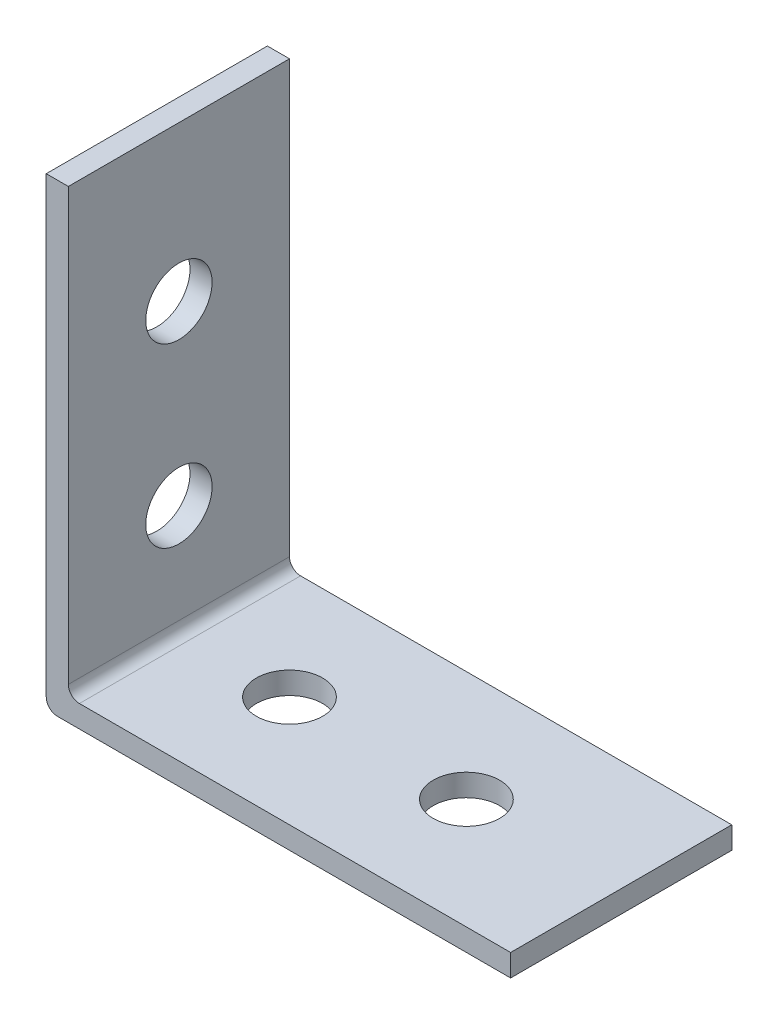
from build123d import *

# Parameters (mm, degrees)
EKSTR_ZYON_NCE1_DEPTH = 5
RADYUS1_R             = 0.5
IZIM2_R               = 1.5
KES_EKSTR_ZYON1_DEPTH = 10
IZIM4_R               = 1.5
KES_EKSTR_ZYON2_DEPTH = 10
SCALE3_SCALE          = 0.6


with BuildPart() as part:
    # Çizim1 → Ekstrüzyon-İnce1 (new, symmetric)
    with BuildSketch(Plane.XY):
        Polygon((20, 0), (0, 0), (0, 20), (-1, 20), (-1, -1), (20, -1), align=None)
    extrude(amount=EKSTR_ZYON_NCE1_DEPTH, both=True)

    # Radyus1
    radyus1_edges = [part.edges().sort_by_distance(p)[0] for p in [
        (-1, -1, 0),
        (0, 0, 0),
    ]]
    fillet(radyus1_edges, radius=RADYUS1_R)

    # Çizim2 → Kes-Ekstrüzyon1 (cut)
    with BuildSketch(Plane(origin=(0, 0, 0), x_dir=(0, 0, -1), z_dir=(1, 0, 0))):
        with Locations((0, 13)):
            Circle(IZIM2_R)
        with Locations((0, 5)):
            Circle(IZIM2_R)
    extrude(amount=-KES_EKSTR_ZYON1_DEPTH, mode=Mode.SUBTRACT)

    # Çizim4 → Kes-Ekstrüzyon2 (cut)
    with BuildSketch(Plane(origin=(0, 0, 0), x_dir=(1, 0, 0), z_dir=(0, 1, 0))):
        with Locations(Location((5, 0, 0), (0, 0, 270))):
            Circle(IZIM4_R)
        with Locations(Location((13, 0, 0), (0, 0, 270))):
            Circle(IZIM4_R)
    extrude(amount=-KES_EKSTR_ZYON2_DEPTH, mode=Mode.SUBTRACT)


with BuildPart() as part_1:
    # Scale3: scaled about (4.650907034, 4.650907034, 0)
    add(part.part.scale(SCALE3_SCALE).moved(Location((1.860362814, 1.860362814, 0))))


solid = part_1.part
